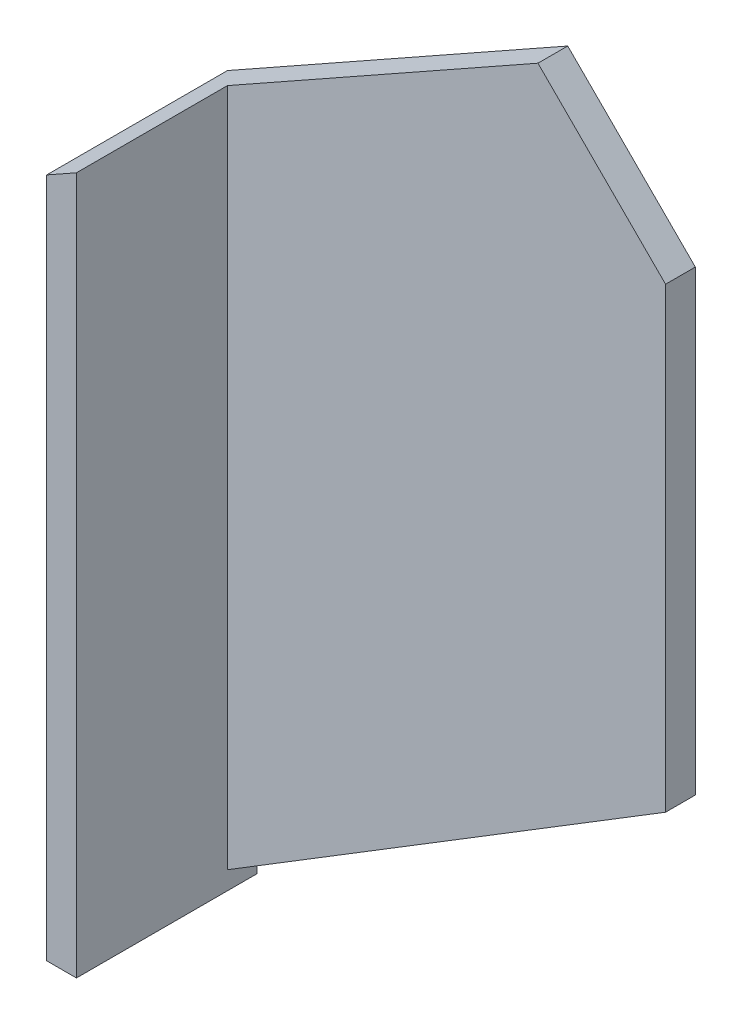
from build123d import *

# Parameters (mm, degrees)
SKETCH_1_R             = 13
EXTRUDE_1_DEPTH        = 14
EXTRUDE_2_DEPTH        = 71
SKETCH_5_R             = 13
CUT_EXTRUDE_3_DEPTH    = 420.252591423
PATTERN_LINEAR_1_COUNT = 4
PATTERN_LINEAR_1_PITCH = 80
SKETCH_7_W             = 85
SKETCH_7_H             = 320
EXTRUDE_3_DEPTH        = 14
EXTRUDE_4_DEPTH        = 14


with BuildPart() as part:
    # 草图1 → 凸台-拉伸1 (new body)
    with BuildSketch(Plane.XY):
        Polygon((-119.656440364, -63.376666372), (-119.656440364, 256.623333628), (40.343559636, 346.623333628), (100.343559636, 286.623333628), (100.343559636, 71.623333628), align=None)
        with Locations((-16.318215015, 232.316337145)):
            Circle(SKETCH_1_R, mode=Mode.SUBTRACT)
        with Locations((36.830892091, 292.109082639)):
            Circle(SKETCH_1_R, mode=Mode.SUBTRACT)
    extrude(amount=EXTRUDE_1_DEPTH)

    # 草图3 → 凸台-拉伸2 (add)
    with BuildSketch(Plane.XY.offset(14)):
        Polygon((-105.656440364, 264.498333628), (-105.656440364, -54.785757281), (-119.656440364, -63.376666372), (-119.656440364, 256.623333628), align=None)
    extrude(amount=EXTRUDE_2_DEPTH)

    # 草图5 → 切除-拉伸3 (cut, through all)
    with BuildSketch(Plane.ZY.offset(119.656440364)):
        with Locations(Location((47, 216.623333628, 0), (0, 0, 270))):
            Circle(SKETCH_5_R)
    cut_extrude_3 = extrude(amount=-CUT_EXTRUDE_3_DEPTH, mode=Mode.SUBTRACT)

    # 阵列(线性)1: 切除-拉伸3 ×4
    with Locations(*[(0, -i * PATTERN_LINEAR_1_PITCH, 0) for i in range(1, PATTERN_LINEAR_1_COUNT)]):
        add(cut_extrude_3, mode=Mode.SUBTRACT)

    # 草图7 → 凸台-拉伸3 (add)
    with BuildSketch(Plane.ZY.offset(119.656440364)):
        with Locations((42.5, 96.623333628)):
            Rectangle(SKETCH_7_W, SKETCH_7_H)
    extrude(amount=-EXTRUDE_3_DEPTH)

    # 草图8 → 凸台-拉伸4 (add)
    with BuildSketch(Plane.XY.offset(14)):
        Polygon((-119.656440364, 256.623333628), (40.343559636, 346.623333628), (100.343559636, 286.623333628), (100.343559636, 71.623333628), (-119.656440364, -63.376666372), align=None)
    extrude(amount=-EXTRUDE_4_DEPTH)


solid = part.part
